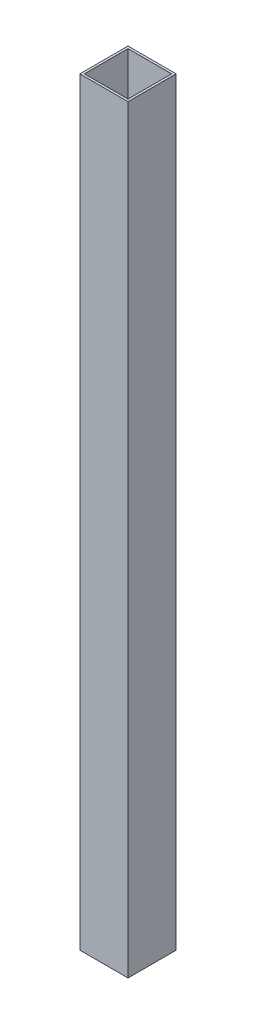
from build123d import *

# Parameters (mm, degrees)
SKETCH2_W           = 25.4
SKETCH2_H           = 25.4
SKETCH2_W_2         = 23
SKETCH2_H_2         = 23
BOSS_EXTRUDE1_DEPTH = 400


with BuildPart() as part:
    # Sketch2 → Boss-Extrude1 (new body)
    with BuildSketch(Plane(origin=(0, 0, 0), x_dir=(1, 0, 0), z_dir=(0, 1, 0))):
        Rectangle(SKETCH2_W, SKETCH2_H)
        Rectangle(SKETCH2_W_2, SKETCH2_H_2, mode=Mode.SUBTRACT)
    extrude(amount=BOSS_EXTRUDE1_DEPTH)


solid = part.part
